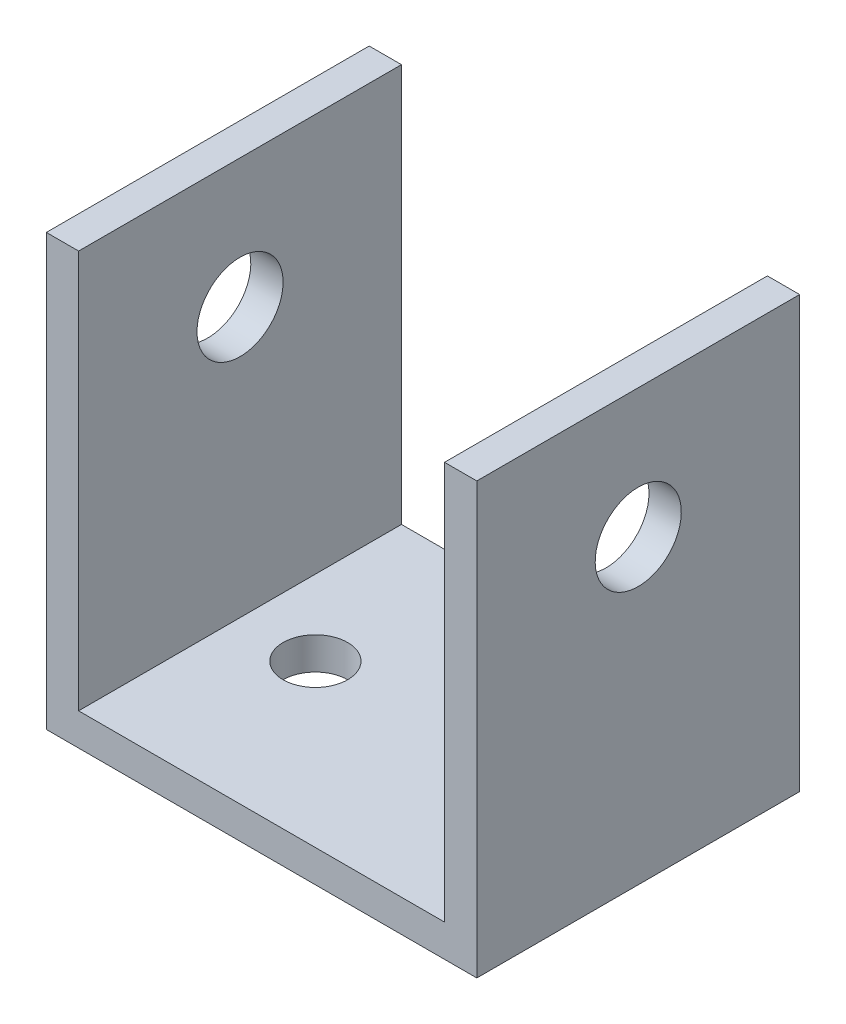
from build123d import *

# Parameters (mm, degrees)
EXTRUSION1_DEPTH = 15
ESQUISSE3_R      = 2
EXTRUSION3_DEPTH = 31.646855226
ESQUISSE4_R      = 1.5
EXTRUSION4_DEPTH = 10


with BuildPart() as part:
    # Esquisse1 → Extrusion1 (new body)
    with BuildSketch(Plane.XY):
        Polygon((-1.5, 17.726526316), (-1.5, -2.273473684), (18.5, -2.273473684), (18.5, 17.726526316), (17, 17.726526316), (17, -0.773473684), (0, -0.773473684), (0, 17.726526316), align=None)
    extrude(amount=EXTRUSION1_DEPTH)

    # Esquisse3 → Extrusion3 (cut, through all)
    with BuildSketch(Plane(origin=(18.5, 0, 0), x_dir=(0, 0, -1), z_dir=(1, 0, 0))):
        with Locations(Location((-7.5, 11.726526316, 0), (0, 0, 90))):
            Circle(ESQUISSE3_R)
    extrude(amount=-EXTRUSION3_DEPTH, mode=Mode.SUBTRACT)

    # Esquisse4 → Extrusion4 (cut)
    with BuildSketch(Plane(origin=(0, -0.773473684, 0), x_dir=(1, 0, 0), z_dir=(0, 1, 0))):
        with Locations(Location((3.5, -7.5, 0), (0, 0, 180))):
            Circle(ESQUISSE4_R)
        with Locations(Location((13.5, -7.5, 0), (0, 0, 180))):
            Circle(ESQUISSE4_R)
    extrude(amount=-EXTRUSION4_DEPTH, mode=Mode.SUBTRACT)


solid = part.part
